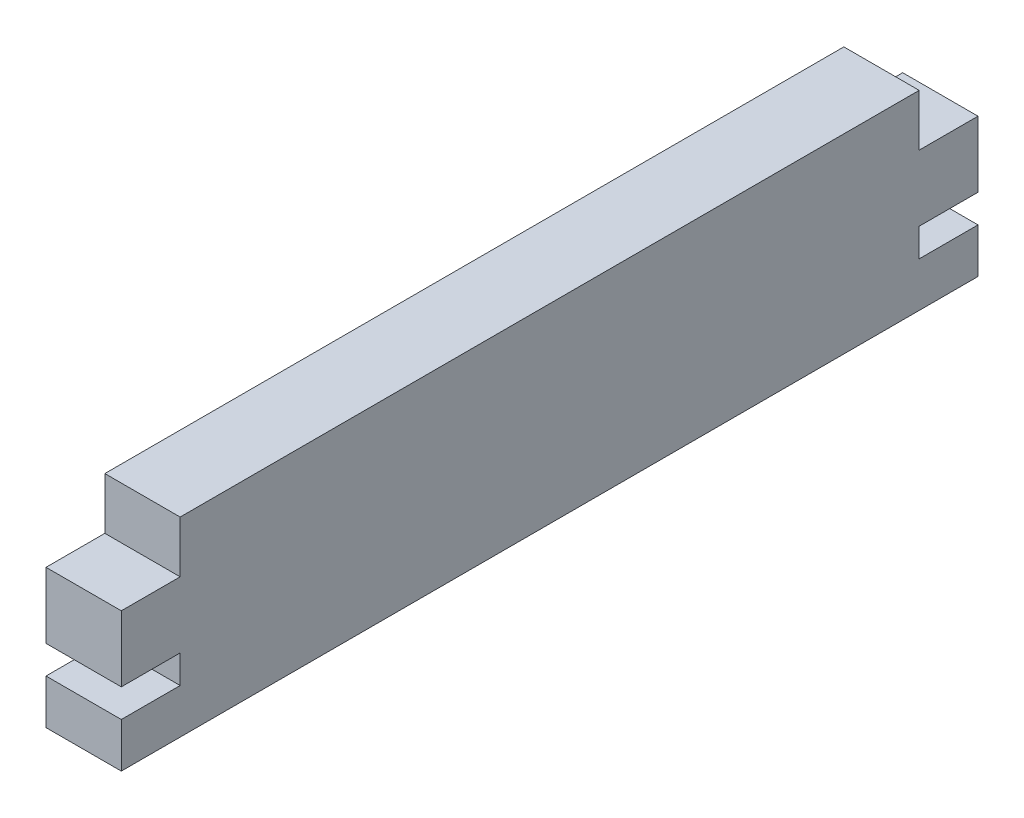
from build123d import *

# Parameters (mm, degrees)
BOSS_EXTRUDE1_DEPTH = 4.064


with BuildPart() as part:
    # Sketch1 → Boss-Extrude1 (new body)
    with BuildSketch(Plane(origin=(0, 0, 0), x_dir=(0, 0, -1), z_dir=(1, 0, 0))):
        Polygon((10.353307799, 10.287), (10.353307799, 0), (33.467307799, 0), (33.467307799, 2.413), (30.292307799, 2.413), (30.292307799, 3.937), (33.467307799, 3.937), (33.467307799, 7.493), (30.292307799, 7.493), (30.292307799, 10.287), align=None)
        Polygon((-12.760692201, 2.413), (-12.760692201, 0), (10.353307799, 0), (10.353307799, 10.287), (-9.585692201, 10.287), (-9.585692201, 7.493), (-12.760692201, 7.493), (-12.760692201, 3.937), (-9.585692201, 3.937), (-9.585692201, 2.413), align=None)
    extrude(amount=BOSS_EXTRUDE1_DEPTH)


solid = part.part
